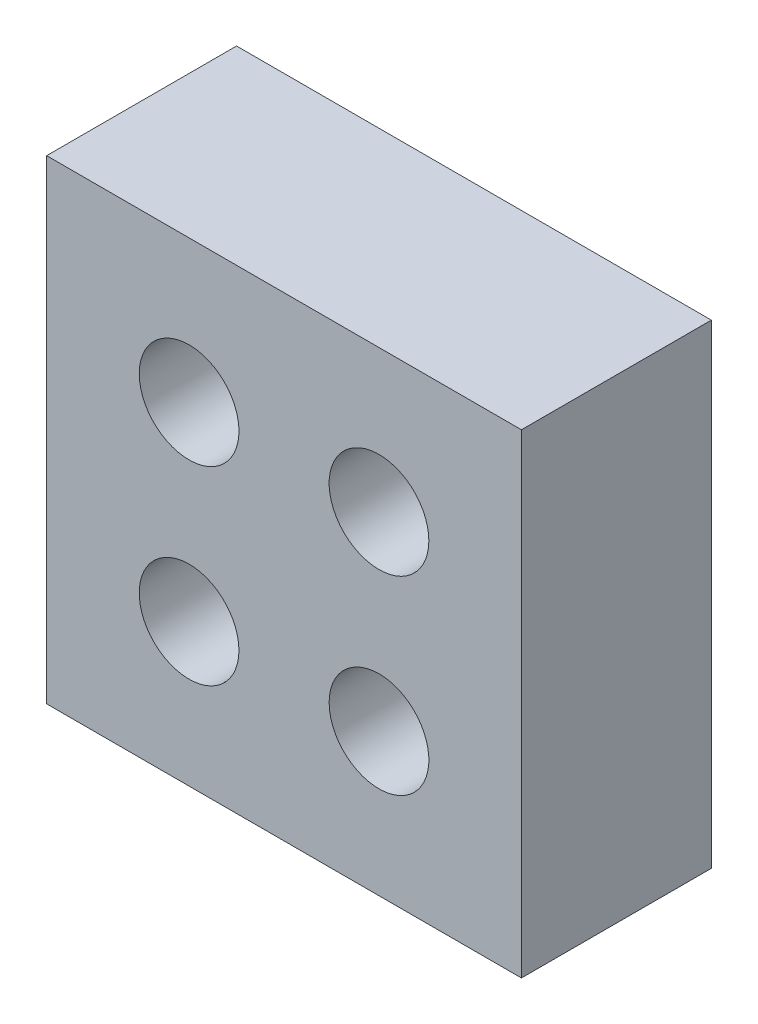
from build123d import *

# Parameters (mm, degrees)
SKETCH_1_W          = 15
SKETCH_1_H          = 15
EXTRUDE_1_DEPTH     = 6
SKETCH_2_R          = 1.575
CUT_EXTRUDE_1_DEPTH = 23.045407685


with BuildPart() as part:
    # 草图1 → 凸台-拉伸1 (new body)
    with BuildSketch(Plane.XY):
        with Locations((7.5, -7.5)):
            Rectangle(SKETCH_1_W, SKETCH_1_H)
    extrude(amount=EXTRUDE_1_DEPTH)

    # 草图2 → 切除-拉伸1 (cut, through all)
    with BuildSketch(Plane.XY.offset(6)):
        with Locations((4.5, -10.5)):
            Circle(SKETCH_2_R)
        with Locations(Location((10.5, -10.5, 0), (0, 0, 180))):
            Circle(SKETCH_2_R)
        with Locations((10.5, -4.5)):
            Circle(SKETCH_2_R)
        with Locations(Location((4.5, -4.5, 0), (0, 0, 180))):
            Circle(SKETCH_2_R)
    extrude(amount=-CUT_EXTRUDE_1_DEPTH, mode=Mode.SUBTRACT)


solid = part.part
